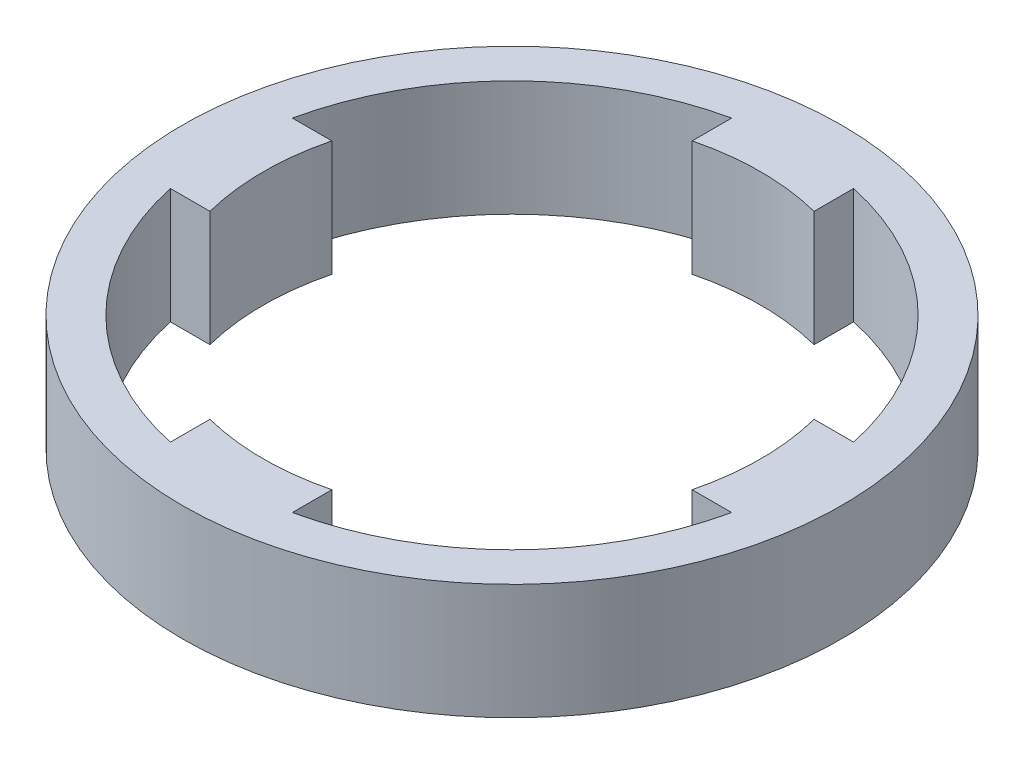
from build123d import *

# Parameters (mm, degrees)
SKETCH_1_R      = 25.675
EXTRUDE_1_DEPTH = 9


with BuildPart() as part:
    # Эскиз1 → Бобышка-Вытянуть1 (new body)
    with BuildSketch(Plane(origin=(0, 0, 0), x_dir=(1, 0, 0), z_dir=(0, 1, 0))):
        with Locations(Location((0, 0, 0), (0, 0, 270))):
            Circle(SKETCH_1_R)
        with BuildLine():
            Line((-4.75, 21.864997713), (-4.75, 18.78371968))
            ThreePointArc((-4.75, 18.78371968), (0, 19.375), (4.75, 18.78371968))
            Line((4.75, 18.78371968), (4.75, 21.864997713))
            ThreePointArc((4.75, 21.864997713), (15.821514229, 15.821514229), (21.864997713, 4.75))
            Line((21.864997713, 4.75), (18.78371968, 4.75))
            ThreePointArc((18.78371968, 4.75), (19.375, 0), (18.78371968, -4.75))
            Line((18.78371968, -4.75), (21.864997713, -4.75))
            ThreePointArc((21.864997713, -4.75), (15.821514229, -15.821514229), (4.75, -21.864997713))
            Line((4.75, -21.864997713), (4.75, -18.78371968))
            ThreePointArc((4.75, -18.78371968), (0, -19.375), (-4.75, -18.78371968))
            Line((-4.75, -18.78371968), (-4.75, -21.864997713))
            ThreePointArc((-4.75, -21.864997713), (-15.821514229, -15.821514229), (-21.864997713, -4.75))
            Line((-21.864997713, -4.75), (-18.78371968, -4.75))
            ThreePointArc((-18.78371968, -4.75), (-19.375, 0), (-18.78371968, 4.75))
            Line((-18.78371968, 4.75), (-21.864997713, 4.75))
            ThreePointArc((-21.864997713, 4.75), (-15.821514229, 15.821514229), (-4.75, 21.864997713))
        make_face(mode=Mode.SUBTRACT)
    extrude(amount=EXTRUDE_1_DEPTH)


solid = part.part
